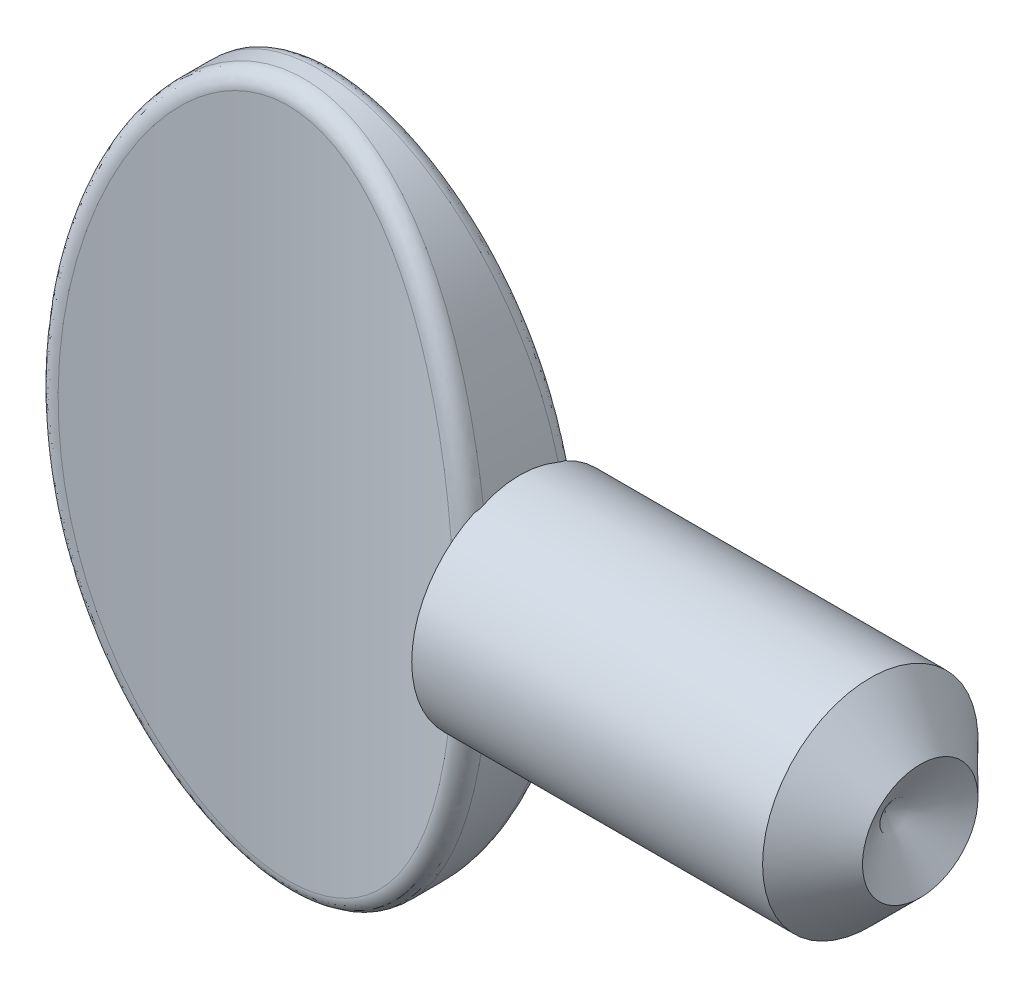
from build123d import *

# Parameters (mm, degrees)
SKETCH1_RX              = 5.715
SKETCH1_RY              = 3.556
EXTRUDE1_DEPTH          = 1.016
CUT_EXTRUDE1_DEPTH      = 7.8072473878947575
CUT_EXTRUDE1_DEPTH_BACK = 7.8072473878947575
SKETCH2_OUTSIDE_W       = 11.834000000000001
SKETCH2_OUTSIDE_H       = 6.754
FILLET3_R               = 0.254


with BuildPart() as part:
    # Sketch1 → Extrude1 (new, symmetric)
    with BuildSketch(Plane.XY):
        with Locations(Location((0, 0), (0, 0, -90))):
            Ellipse(SKETCH1_RX, SKETCH1_RY)
    extrude(amount=EXTRUDE1_DEPTH, both=True)

    # Sketch2 outside → Cut-Extrude1 (cut, two sides: drawn at the far end of the back side and taken through both)
    with BuildSketch(Plane(origin=(0, 0, 0), x_dir=(1, 0, 0), z_dir=(0, 1, 0)).offset(-CUT_EXTRUDE1_DEPTH_BACK)):
        Rectangle(SKETCH2_OUTSIDE_W, SKETCH2_OUTSIDE_H)
        with BuildLine():
            Line((-3.556, 1.016), (-3.556, -1.016))
            ThreePointArc((-3.556, -1.016), (6.3e-16, -0.3810000000000002), (3.556, -1.016))
            Line((3.556, -1.016), (3.556, 1.016))
            ThreePointArc((3.556, 1.016), (6.3e-16, 0.3810000000000002), (-3.556, 1.016))
        make_face(mode=Mode.SUBTRACT)
    extrude(amount=CUT_EXTRUDE1_DEPTH + CUT_EXTRUDE1_DEPTH_BACK, mode=Mode.SUBTRACT)

    # Fillet3
    fillet3_edges = [part.edges().sort_by_distance(p)[0] for p in [
        (-2.772297743363364, -3.579097133488567, 0.7620899166368158),
        (6.761380256e-08, 5.714999999994567, -0.38099999999467776),
    ]]
    fillet(fillet3_edges, radius=FILLET3_R)

    # Sketch3 → Revolve1 (revolve)
    with BuildSketch(Plane(origin=(0, 0, 0), x_dir=(1, 0, 0), z_dir=(0, 1, 0))):
        with BuildLine():
            Line((9.093200000000003, 1.7526), (9.906, 0.9398))
            Line((9.906, 0.9398), (9.341311190237892, -1.1e-16))
            Line((9.341311190237892, -1.1e-16), (2.577464628985661, 1e-17))
            Line((2.577464628985661, 1e-17), (2.577464628985661, 0.7095513315322604))
            ThreePointArc((2.577464628985661, 0.7095513315322604), (3.1592934071520324, 1.093146291526699), (3.3846611661960426, 1.7526000000000004))
            Line((3.3846611661960426, 1.7526000000000004), (4.741333333333333, 1.7526))
            Line((4.741333333333333, 1.7526), (9.093200000000003, 1.7526))
        make_face()
    revolve(axis=Axis((0, 0, 0), (1, 0, 0)))


solid = part.part
